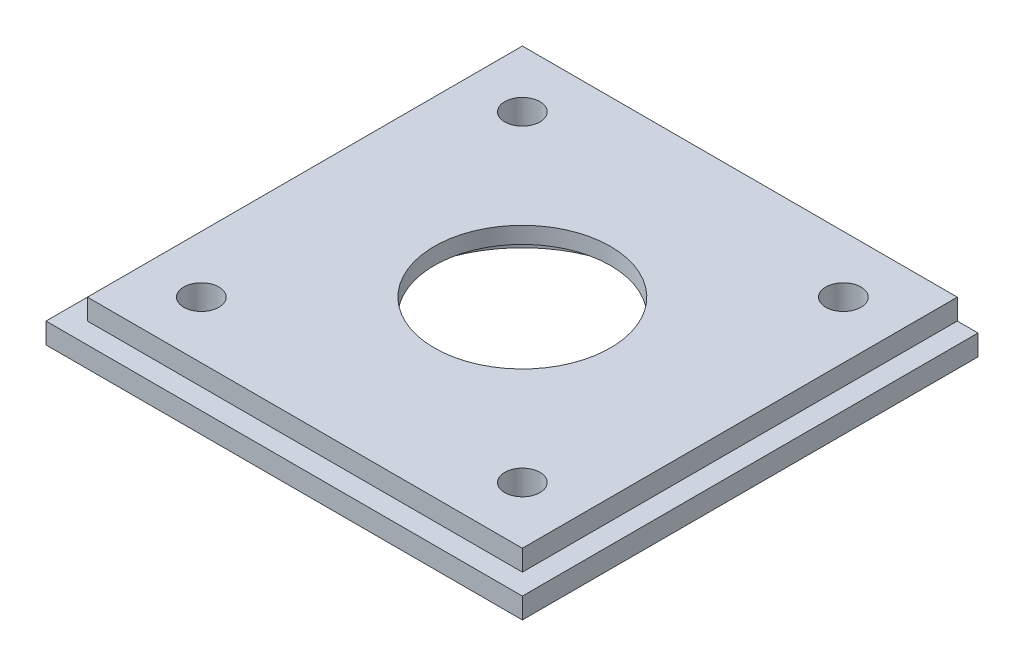
from build123d import *

# Parameters (mm, degrees)
SKIZZE1_W                       = 42
SKIZZE1_H                       = 42
SKIZZE1_R                       = 1.7
SKIZZE1_R_2                     = 8.5
AUFSATZ_LINEAR_AUSTRAGEN1_DEPTH = 4
SKIZZE2_R                       = 11.5
SCHNITT_LINEAR_AUSTRAGEN1_DEPTH = 2.4
AUFSATZ_LINEAR_AUSTRAGEN2_DEPTH = 2


with BuildPart() as part:
    # Skizze1 → Aufsatz-Linear austragen1 (new body)
    with BuildSketch(Plane(origin=(0, 0, 0), x_dir=(1, 0, 0), z_dir=(0, 1, 0))):
        Rectangle(SKIZZE1_W, SKIZZE1_H)
        with Locations(Location((-15.5, 15.5, 0), (0, 0, 270))):
            Circle(SKIZZE1_R, mode=Mode.SUBTRACT)
        with Locations(Location((15.5, 15.5, 0), (0, 0, 270))):
            Circle(SKIZZE1_R, mode=Mode.SUBTRACT)
        with Locations(Location((-15.5, -15.5, 0), (0, 0, 270))):
            Circle(SKIZZE1_R, mode=Mode.SUBTRACT)
        with Locations(Location((15.5, -15.5, 0), (0, 0, 270))):
            Circle(SKIZZE1_R, mode=Mode.SUBTRACT)
        with Locations(Location((0, 0, 0), (0, 0, 270))):
            Circle(SKIZZE1_R_2, mode=Mode.SUBTRACT)
    extrude(amount=AUFSATZ_LINEAR_AUSTRAGEN1_DEPTH)

    # Skizze2 → Schnitt-Linear austragen1 (cut)
    with BuildSketch(Plane.XZ):
        with Locations(Location((0, 0, 0), (0, 0, 270))):
            Circle(SKIZZE2_R)
    extrude(amount=-SCHNITT_LINEAR_AUSTRAGEN1_DEPTH, mode=Mode.SUBTRACT)

    # Skizze4 → Aufsatz-Linear austragen2 (add)
    with BuildSketch(Plane.XZ):
        Polygon((-21, -21), (-21, 21), (21, 21), (21, -21), (23, -21), (23, 23), (-23, 23), (-23, -21), align=None)
    extrude(amount=-AUFSATZ_LINEAR_AUSTRAGEN2_DEPTH)


solid = part.part
